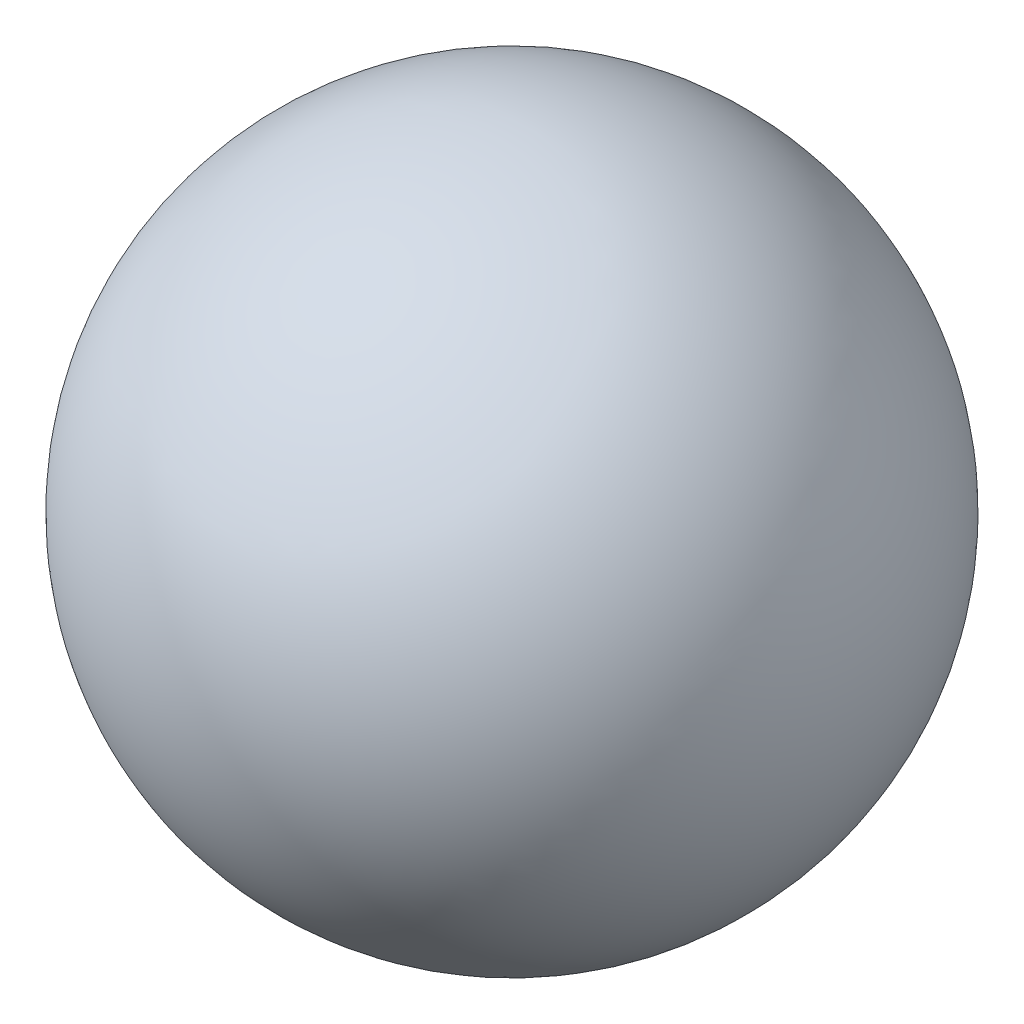
from build123d import *
from build123d.topology import SkipClean


with BuildPart() as part:
    # 草图1 → 旋转2 (revolve)
    with SkipClean():  # the faces are left unmerged after this step: merging them gives an invalid solid
        with BuildSketch(Plane(origin=(0, 0, 0), x_dir=(1, 0, 0), z_dir=(0, 1, 0))):
            with BuildLine():
                ThreePointArc((8.27, 0), (5.84777308, 5.84777308), (0, 8.27))
                Line((0, 8.27), (0, -8.27))
                ThreePointArc((0, -8.27), (5.84777308, -5.84777308), (8.27, 0))
            make_face()
            with BuildLine():
                Line((0, -8.27), (0, 8.27))
                ThreePointArc((0, 8.27), (-8.27, 0), (0, -8.27))
            make_face()
        revolve(axis=Axis((0, 0, -12.114985007), (0, 0, 1)))


solid = part.part
